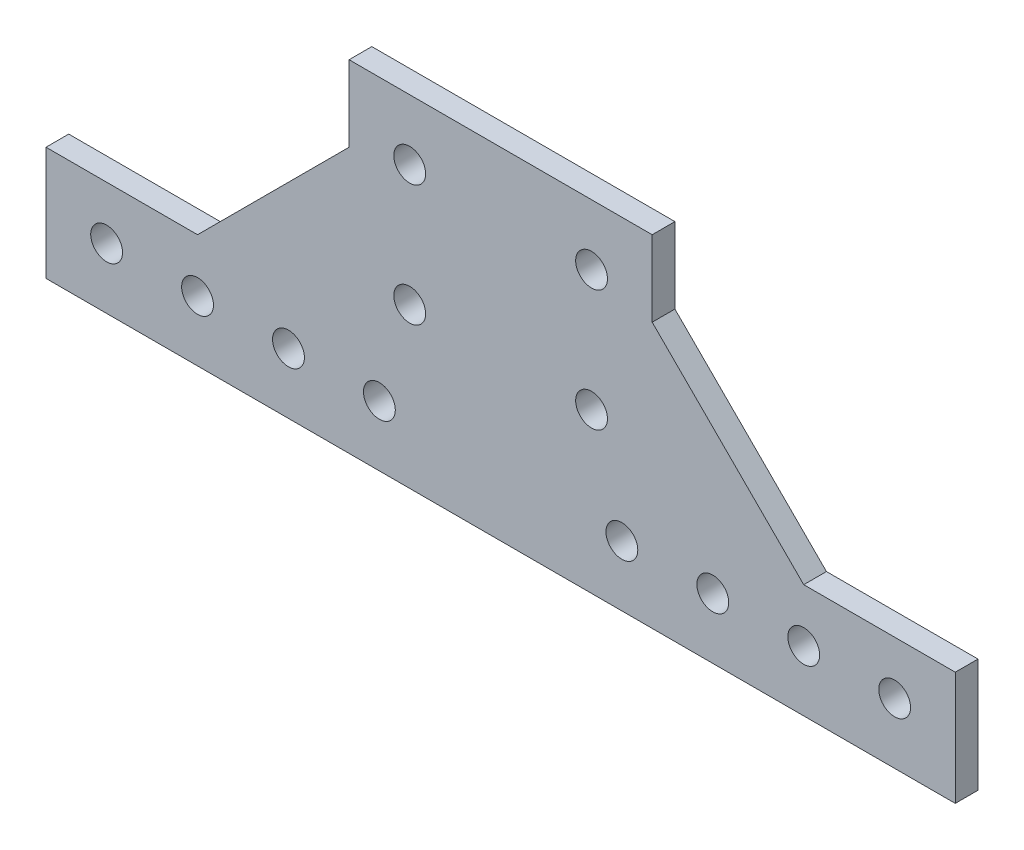
from build123d import *

# Parameters (mm, degrees)
EXTRUDE_1_DEPTH     = 3
SKETCH_2_R          = 2.1
CUT_EXTRUDE_1_DEPTH = 3
SKETCH_3_R          = 2.1
CUT_EXTRUDE_2_DEPTH = 129.195163715


with BuildPart() as part:
    # 草图1 → 凸台-拉伸1 (new body)
    with BuildSketch(Plane.XY):
        Polygon((0, 0), (120, 0), (120, 15), (100, 15), (80, 35), (80, 45), (40, 45), (40, 35), (20, 15), (0, 15), align=None)
    extrude(amount=EXTRUDE_1_DEPTH)

    # 草图2 → 切除-拉伸1 (cut)
    with BuildSketch(Plane.XY.offset(3)):
        with Locations((48, 37)):
            Circle(SKETCH_2_R)
        with Locations((72, 37)):
            Circle(SKETCH_2_R)
        with Locations((48, 21)):
            Circle(SKETCH_2_R)
        with Locations((72, 21)):
            Circle(SKETCH_2_R)
        with Locations((8, 8)):
            Circle(SKETCH_2_R)
        with Locations((20, 8)):
            Circle(SKETCH_2_R)
        with Locations((100, 8)):
            Circle(SKETCH_2_R)
        with Locations((112, 8)):
            Circle(SKETCH_2_R)
    extrude(amount=-CUT_EXTRUDE_1_DEPTH, mode=Mode.SUBTRACT)

    # 草图3 → 切除-拉伸2 (cut, through all)
    with BuildSketch(Plane.XY.offset(3)):
        with Locations((32, 8)):
            Circle(SKETCH_3_R)
        with Locations((44, 8)):
            Circle(SKETCH_3_R)
        with Locations((76, 8)):
            Circle(SKETCH_3_R)
        with Locations((88, 8)):
            Circle(SKETCH_3_R)
    extrude(amount=-CUT_EXTRUDE_2_DEPTH, mode=Mode.SUBTRACT)


solid = part.part
